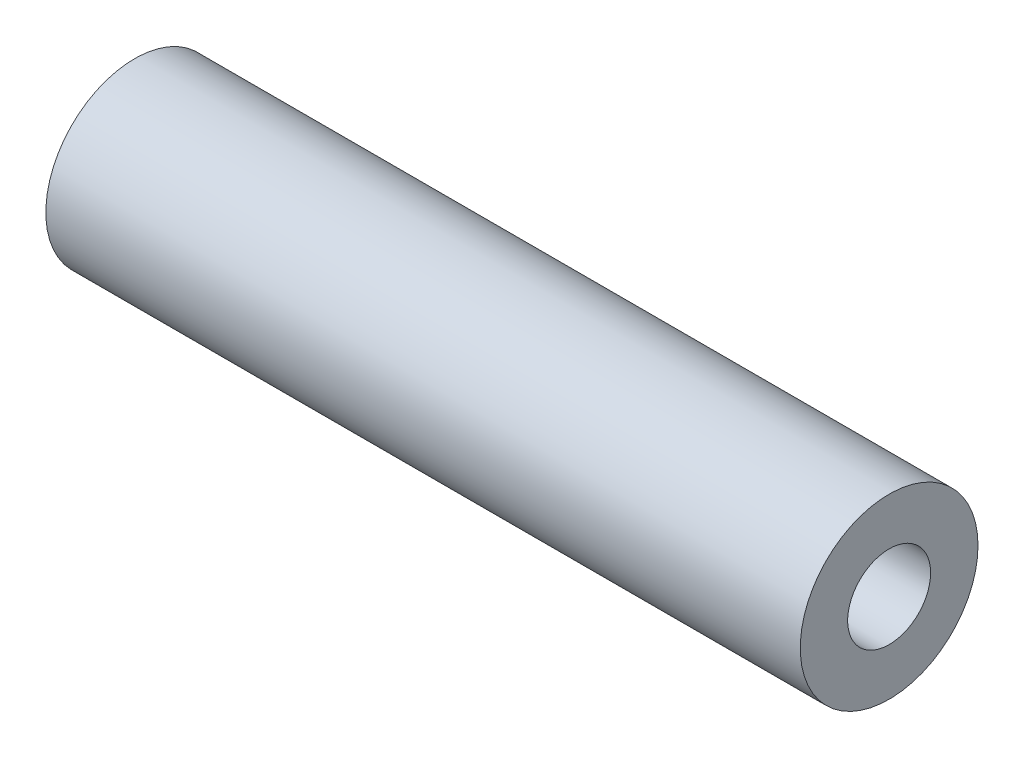
from build123d import *

# Parameters (mm, degrees)
SKETCH_1_R      = 4.5
SKETCH_1_R_2    = 2.1
EXTRUDE_1_DEPTH = 38.2


with BuildPart() as part:
    # 草图1 → 凸台-拉伸1 (new body)
    with BuildSketch(Plane(origin=(0, 0, 0), x_dir=(0, 0, -1), z_dir=(1, 0, 0))):
        Circle(SKETCH_1_R)
        Circle(SKETCH_1_R_2, mode=Mode.SUBTRACT)
    extrude(amount=EXTRUDE_1_DEPTH)


solid = part.part
